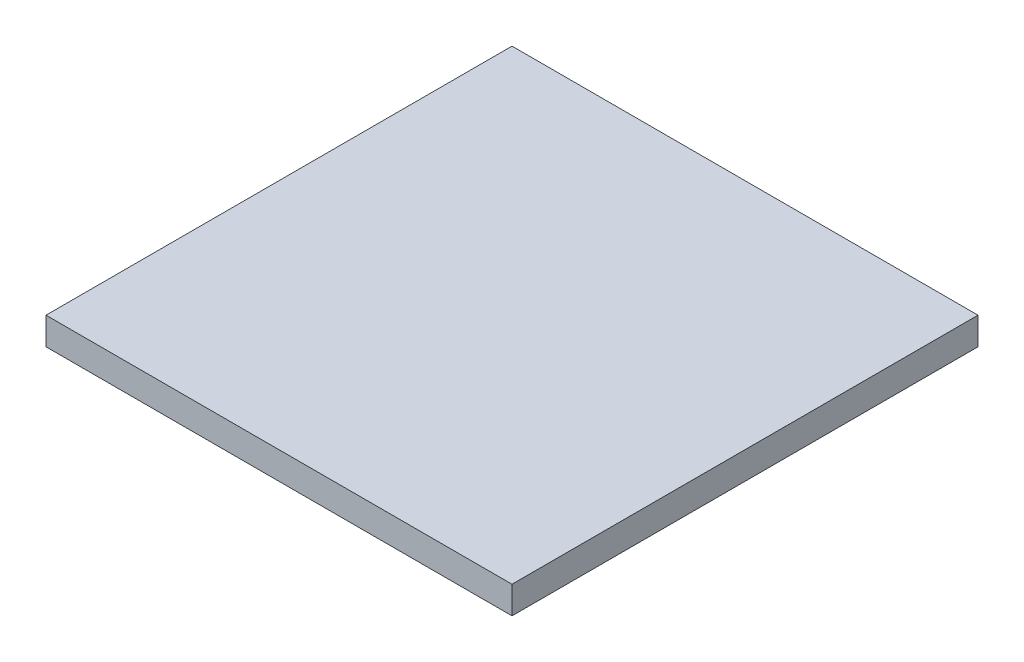
from build123d import *

# Parameters (mm, degrees)
SKETCH1_W           = 67.99999989
SKETCH1_H           = 67.99999989
BOSS_EXTRUDE1_DEPTH = 4


with BuildPart() as part:
    # Sketch1 → Boss-Extrude1 (new body)
    with BuildSketch(Plane(origin=(0, 0, 0), x_dir=(1, 0, 0), z_dir=(0, 1, 0))):
        with Locations((-16.133538564, -2.569869612)):
            Rectangle(SKETCH1_W, SKETCH1_H)
    extrude(amount=BOSS_EXTRUDE1_DEPTH)


solid = part.part
